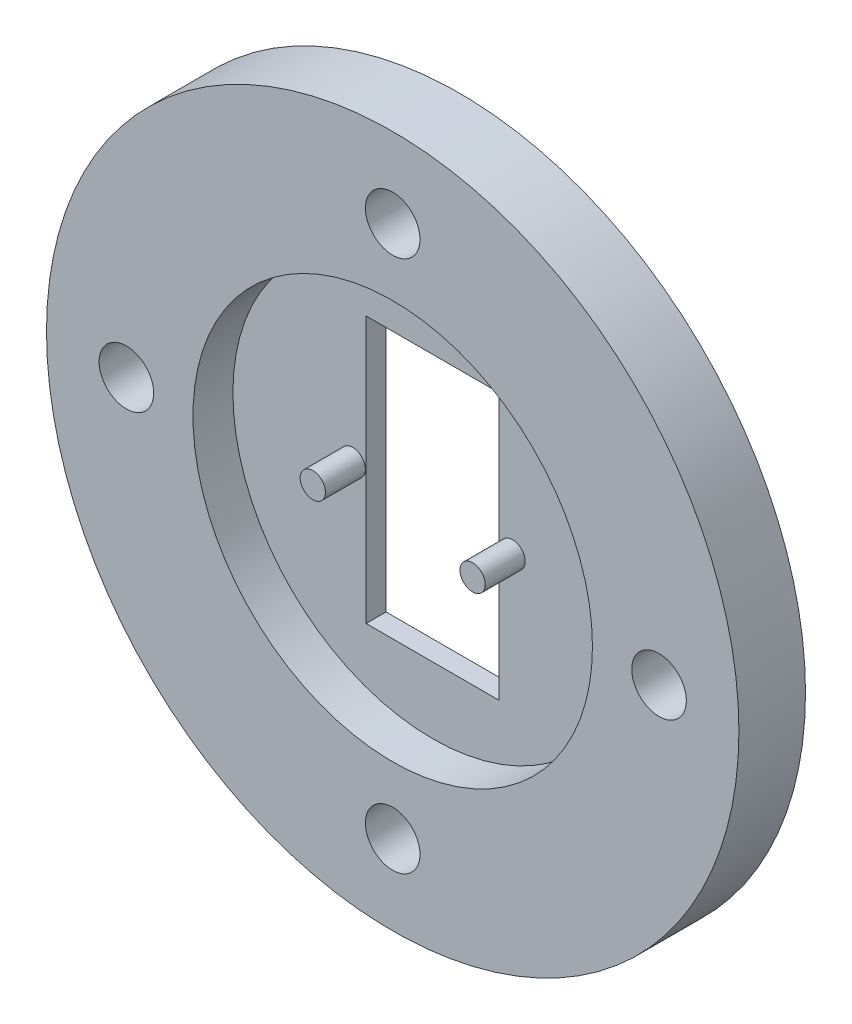
from build123d import *

# Parameters (mm, degrees)
SKETCH_1_R               = 26
EXTRUDE_1_DEPTH          = 5
SKETCH_2_R               = 2.05
CUT_EXTRUDE_1_DEPTH      = 38.107950631
PATTERN_CIRCULAR_1_COUNT = 4
SKETCH_3_R               = 15
CUT_EXTRUDE_2_DEPTH      = 0.5
CUT_EXTRUDE_START        = -3
SKETCH_4_R               = 15
CUT_EXTRUDE_3_DEPTH      = 3
SKETCH_5_W               = 10
SKETCH_5_H               = 20
CUT_EXTRUDE_4_DEPTH      = 37.891733491
SKETCH_6_R               = 0.95
EXTRUDE_2_DEPTH          = 3


with BuildPart() as part:
    # 草图1 → 凸台-拉伸1 (new body)
    with BuildSketch(Plane.XY):
        Circle(SKETCH_1_R)
    extrude(amount=EXTRUDE_1_DEPTH)

    # 草图2 → 切除-拉伸1 (cut, through all)
    with BuildSketch(Plane(origin=(0, 0, 0), x_dir=(-1, 0, 0), z_dir=(0, 0, -1))):
        with Locations((0, 20)):
            Circle(SKETCH_2_R)
    cut_extrude_1 = extrude(amount=-CUT_EXTRUDE_1_DEPTH, mode=Mode.SUBTRACT)

    # 阵列(圆周)1: 切除-拉伸1 ×4 about axis
    pattern_circular_1_axis = Axis((0, 0, 0), (0, 0, 1))
    for i in range(1, PATTERN_CIRCULAR_1_COUNT):
        add(cut_extrude_1.rotate(pattern_circular_1_axis, i * 360 / PATTERN_CIRCULAR_1_COUNT), mode=Mode.SUBTRACT)

    # 草图3 → 切除-拉伸2 (cut)
    with BuildSketch(Plane(origin=(0, 0, 0), x_dir=(-1, 0, 0), z_dir=(0, 0, -1))):
        Circle(SKETCH_3_R)
    extrude(amount=-CUT_EXTRUDE_2_DEPTH, mode=Mode.SUBTRACT)

    # 草图4 → 切除-拉伸3 (cut)
    with BuildSketch(Plane.XY.offset(5).offset(CUT_EXTRUDE_START)):
        with Locations(Location((0, 0, 0), (0, 0, 180))):
            Circle(SKETCH_4_R)
    extrude(amount=CUT_EXTRUDE_3_DEPTH, mode=Mode.SUBTRACT)

    # 草图5 → 切除-拉伸4 (cut, through all)
    with BuildSketch(Plane.XY.offset(2)):
        Rectangle(SKETCH_5_W, SKETCH_5_H)
    extrude(amount=-CUT_EXTRUDE_4_DEPTH, mode=Mode.SUBTRACT)

    # 草图6 → 凸台-拉伸2 (add)
    with BuildSketch(Plane.XY.offset(2)):
        with Locations(Location((-6, 0, 0), (0, 0, 180))):
            Circle(SKETCH_6_R)
    extrude_2 = extrude(amount=EXTRUDE_2_DEPTH)

    # 镜向1: 凸台-拉伸2 across plane
    add(extrude_2.mirror(Plane(origin=(0, 0, 0), x_dir=(0, 0, 1), z_dir=(1, 0, 0))))


solid = part.part
